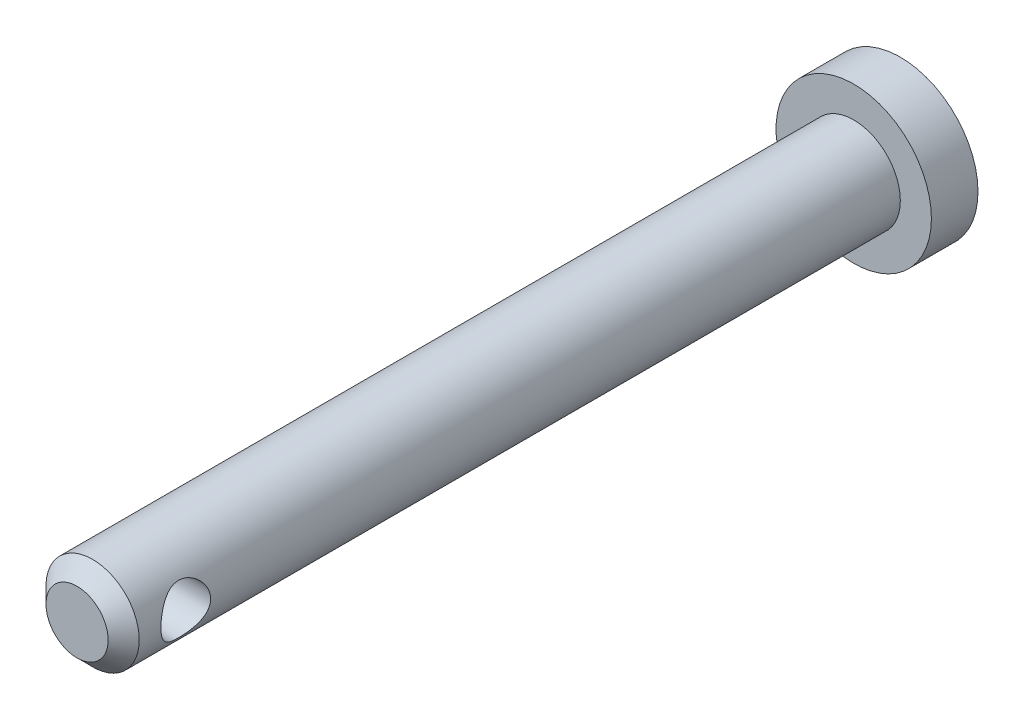
from build123d import *

# Parameters (mm, degrees)
SKETCH_1_R          = 2.5
EXTRUDE_1_DEPTH     = 1.5
SKETCH_2_R          = 1.5
EXTRUDE_2_DEPTH     = 25
SKETCH_3_R          = 0.8
CUT_EXTRUDE_1_DEPTH = 27.916537667
CHAMFER_1_SIZE      = 0.5


with BuildPart() as part:
    # 草图1 → 凸台-拉伸1 (new body)
    with BuildSketch(Plane.XY):
        Circle(SKETCH_1_R)
    extrude(amount=EXTRUDE_1_DEPTH)

    # 草图2 → 凸台-拉伸2 (add)
    with BuildSketch(Plane.XY.offset(1.5)):
        Circle(SKETCH_2_R)
    extrude(amount=EXTRUDE_2_DEPTH)

    # 草图3 → 切除-拉伸1 (cut, through all)
    with BuildSketch(Plane(origin=(1.5, 0, 0), x_dir=(0, 0, -1), z_dir=(1, 0, 0))):
        with Locations(Location((-24.5, 0, 0), (0, 0, 180))):
            Circle(SKETCH_3_R)
    extrude(amount=-CUT_EXTRUDE_1_DEPTH, mode=Mode.SUBTRACT)

    # 倒角1
    chamfer_1_edges = [part.edges().sort_by_distance(p)[0] for p in [
        (-1.5, 0, 26.5),
    ]]
    chamfer(chamfer_1_edges, length=CHAMFER_1_SIZE)


solid = part.part
